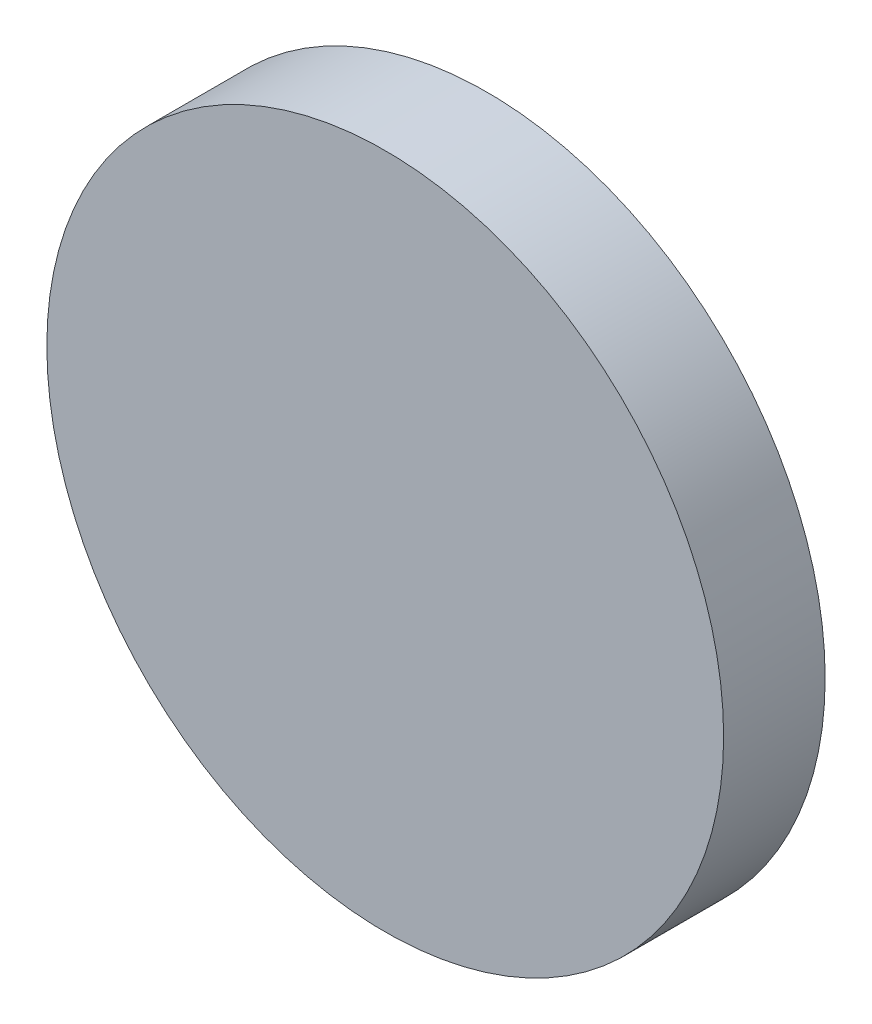
from build123d import *

# Parameters (mm, degrees)
SKETCH1_R           = 100
BOSS_EXTRUDE1_DEPTH = 30


with BuildPart() as part:
    # Sketch1 → Boss-Extrude1 (new body)
    with BuildSketch(Plane.XY):
        Circle(SKETCH1_R)
    extrude(amount=BOSS_EXTRUDE1_DEPTH)


solid = part.part
